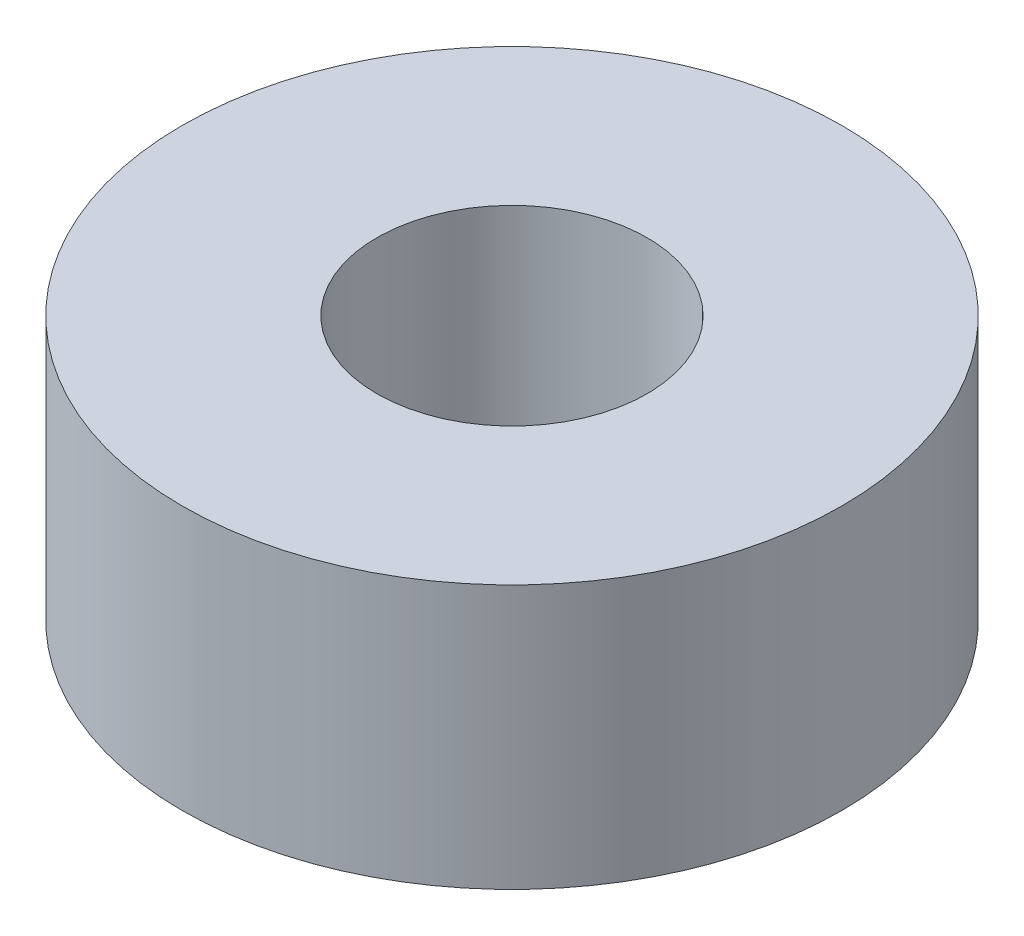
from build123d import *

# Parameters (mm, degrees)
SKETCH_1_R      = 5
SKETCH_1_R_2    = 2.05
EXTRUDE_1_DEPTH = 2


with BuildPart() as part:
    # 草图1 → 凸台-拉伸1 (new, symmetric)
    with BuildSketch(Plane(origin=(0, 0, 0), x_dir=(1, 0, 0), z_dir=(0, 1, 0))):
        with Locations(Location((0, 0, 0), (0, 0, 270))):
            Circle(SKETCH_1_R)
        with Locations(Location((0, 0, 0), (0, 0, 270))):
            Circle(SKETCH_1_R_2, mode=Mode.SUBTRACT)
    extrude(amount=EXTRUDE_1_DEPTH, both=True)


solid = part.part
